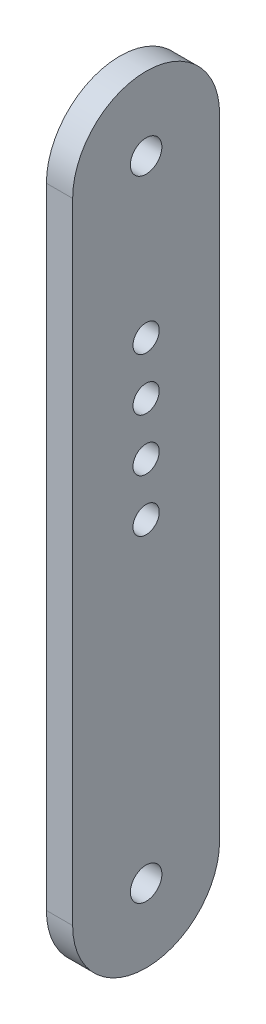
from build123d import *

# Parameters (mm, degrees)
SKETCH1_R           = 1.5
SKETCH1_R_2         = 1.25
BOSS_EXTRUDE1_DEPTH = 2.5


with BuildPart() as part:
    # Sketch1 → Boss-Extrude1 (new body)
    with BuildSketch(Plane(origin=(0, 0, 0), x_dir=(0, 0, -1), z_dir=(1, 0, 0))):
        with BuildLine():
            Line((-7, 0), (-7, 60))
            ThreePointArc((-7, 60), (0, 67), (7, 60))
            Line((7, 60), (7, 0))
            ThreePointArc((7, 0), (0, -7), (-7, 0))
        make_face()
        Circle(SKETCH1_R, mode=Mode.SUBTRACT)
        with Locations((0, 60)):
            Circle(SKETCH1_R, mode=Mode.SUBTRACT)
        with Locations((0, 45)):
            Circle(SKETCH1_R_2, mode=Mode.SUBTRACT)
        with Locations((0, 40)):
            Circle(SKETCH1_R_2, mode=Mode.SUBTRACT)
        with Locations((0, 35)):
            Circle(SKETCH1_R_2, mode=Mode.SUBTRACT)
        with Locations((0, 30)):
            Circle(SKETCH1_R_2, mode=Mode.SUBTRACT)
    extrude(amount=BOSS_EXTRUDE1_DEPTH)


solid = part.part
